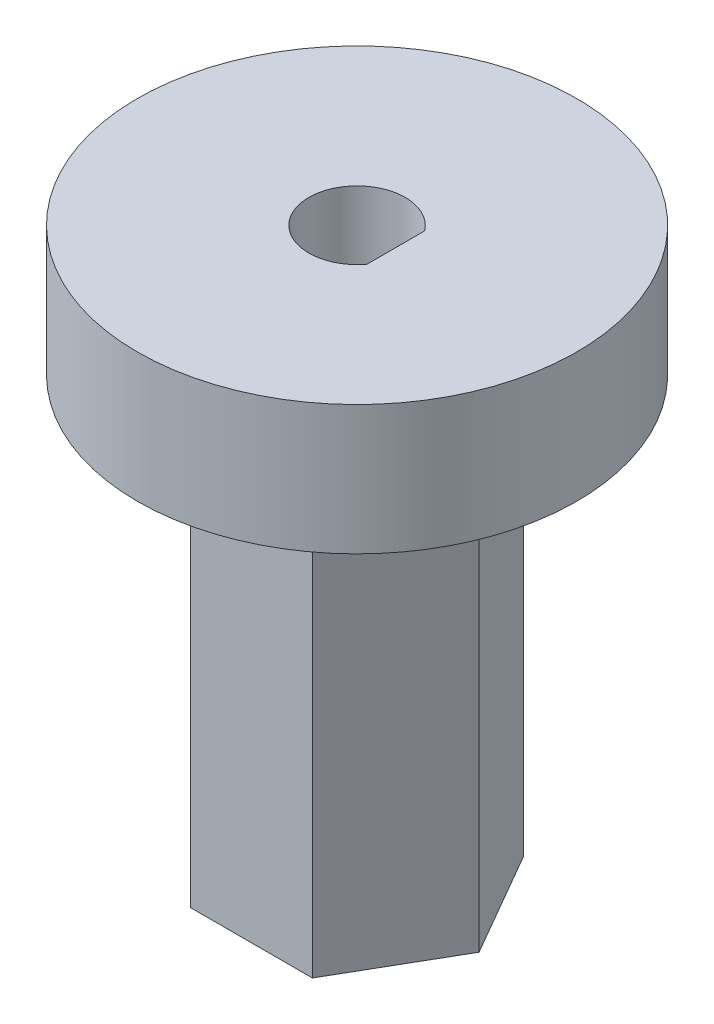
from build123d import *

# Parameters (mm, degrees)
SKETCH1_R           = 11.43
BOSS_EXTRUDE1_DEPTH = 6.731
BOSS_EXTRUDE2_START = -22.86
BOSS_EXTRUDE2_DEPTH = 22.86


with BuildPart() as part:
    # Sketch1 → Boss-Extrude1 (new body)
    with BuildSketch(Plane(origin=(0, 0, 0), x_dir=(1, 0, 0), z_dir=(0, 1, 0))):
        Circle(SKETCH1_R)
        with BuildLine():
            Line((2.014584776, 1.499860387), (2.014584776, -1.499860387))
            ThreePointArc((2.014584776, -1.499860387), (-2.51159969, 0), (2.014584776, 1.499860387))
        make_face(mode=Mode.SUBTRACT)
    extrude(amount=BOSS_EXTRUDE1_DEPTH)

    # Sketch1<3> → Boss-Extrude2 (add)
    with BuildSketch(Plane(origin=(0, 0, 0), x_dir=(1, 0, 0), z_dir=(0, 1, 0)).offset(BOSS_EXTRUDE2_START)):
        Polygon((-6.35, 0), (-3.175, -5.499261314), (3.175, -5.499261314), (6.35, 0), (3.175, 5.499261314), (-3.175, 5.499261314), align=None)
        with BuildLine():
            Line((2.014584776, 1.499860387), (2.014584776, -1.499860387))
            ThreePointArc((2.014584776, -1.499860387), (-2.51159969, 0), (2.014584776, 1.499860387))
        make_face(mode=Mode.SUBTRACT)
    extrude(amount=BOSS_EXTRUDE2_DEPTH)


solid = part.part
